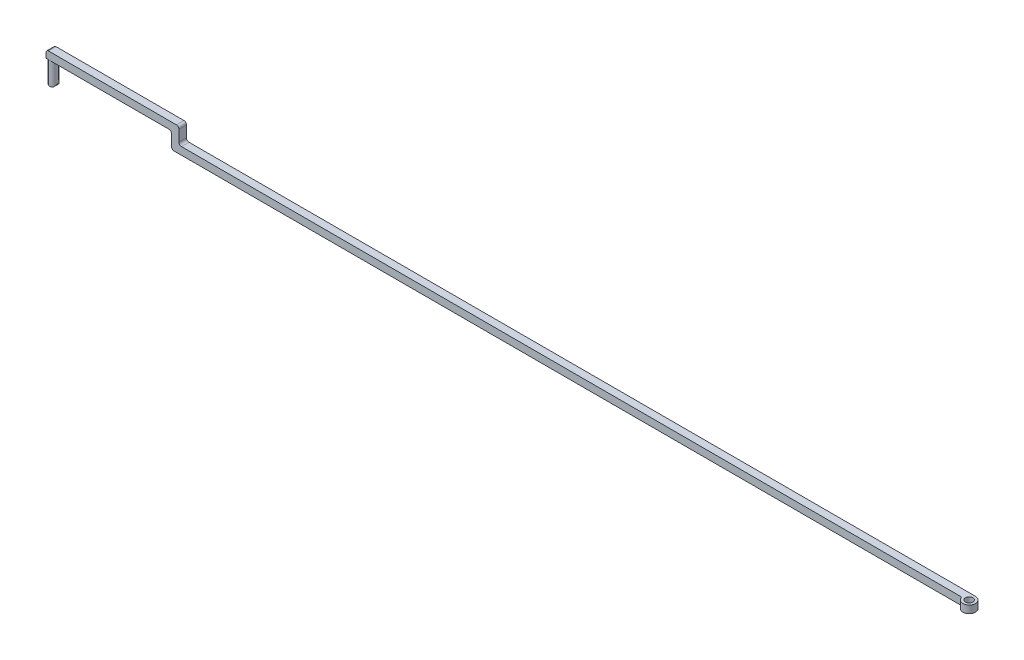
from build123d import *

# Parameters (mm, degrees)
SCHIZZO1_W                   = 185
SCHIZZO1_H                   = 6
ESTRUSIONE_ESTRUSIONE1_DEPTH = 1.5
SCHIZZO2_OUTSIDE_W           = 224.02
SCHIZZO2_OUTSIDE_H           = 45.02
TAGLIO_ESTRUSIONE1_DEPTH     = 1.5
SCHIZZO5_W                   = 2.294465176
SCHIZZO5_H                   = 1.827727815
SCHIZZO5_R                   = 0.75
TAGLIO_ESTRUSIONE3_DEPTH     = 4.5
SCHIZZO6_R                   = 1.25
ESTRUSIONE_ESTRUSIONE3_DEPTH = 1.5
SCHIZZO7_R                   = 0.75
TAGLIO_ESTRUSIONE4_DEPTH     = 1.5


with BuildPart() as part:
    # Schizzo1 → Estrusione-Estrusione1 (new body)
    with BuildSketch(Plane.XY):
        with Locations((-92.5, 3)):
            Rectangle(SCHIZZO1_W, SCHIZZO1_H)
    extrude(amount=ESTRUSIONE_ESTRUSIONE1_DEPTH)

    # Schizzo2 outside → Taglio-Estrusione1 (cut)
    with BuildSketch(Plane.XY.offset(1.5)):
        with Locations((-92.5, 3)):
            Rectangle(SCHIZZO2_OUTSIDE_W, SCHIZZO2_OUTSIDE_H)
        with BuildLine():
            Line((-184.5, 0), (-184, 0))
            ThreePointArc((-184, 0), (-183.646446609, 0.146446609), (-183.5, 0.5))
            Line((-183.5, 0.5), (-183.5, 4))
            ThreePointArc((-183.5, 4), (-183.353553391, 4.353553391), (-183, 4.5))
            Line((-183, 4.5), (-160.5, 4.5))
            ThreePointArc((-160.5, 4.5), (-160.146446609, 4.353553391), (-160, 4))
            Line((-160, 4), (-160, 1.75))
            ThreePointArc((-160, 1.75), (-159.853553391, 1.396446609), (-159.5, 1.25))
            Line((-159.5, 1.25), (0, 1.25))
            Line((0, 1.25), (0, 2.75))
            Line((0, 2.75), (-158, 2.75))
            ThreePointArc((-158, 2.75), (-158.353553391, 2.896446609), (-158.5, 3.25))
            Line((-158.5, 3.25), (-158.5, 5.5))
            ThreePointArc((-158.5, 5.5), (-158.646446609, 5.853553391), (-159, 6))
            Line((-159, 6), (-184.5, 6))
            ThreePointArc((-184.5, 6), (-184.853553391, 5.853553391), (-185, 5.5))
            Line((-185, 5.5), (-185, 0.5))
            ThreePointArc((-185, 0.5), (-184.853553391, 0.146446609), (-184.5, 0))
        make_face(mode=Mode.SUBTRACT)
    extrude(amount=-TAGLIO_ESTRUSIONE1_DEPTH, mode=Mode.SUBTRACT)

    # Schizzo5 → Taglio-Estrusione3 (cut)
    with BuildSketch(Plane.XZ):
        with Locations((-184.019602527, 0.694189627)):
            Rectangle(SCHIZZO5_W, SCHIZZO5_H)
        with Locations(Location((-184.25, 0.75, 0), (0, 0, 180))):
            Circle(SCHIZZO5_R, mode=Mode.SUBTRACT)
    extrude(amount=-TAGLIO_ESTRUSIONE3_DEPTH, mode=Mode.SUBTRACT)

    # Schizzo6 → Estrusione-Estrusione3 (add)
    with BuildSketch(Plane(origin=(0, 2.75, 0), x_dir=(1, 0, 0), z_dir=(0, 1, 0))):
        with Locations((-1.224744871, -1.25)):
            Circle(SCHIZZO6_R)
    extrude(amount=-ESTRUSIONE_ESTRUSIONE3_DEPTH)

    # Schizzo7 → Taglio-Estrusione4 (cut)
    with BuildSketch(Plane(origin=(0, 2.75, 0), x_dir=(1, 0, 0), z_dir=(0, 1, 0))):
        with Locations(Location((-1.224744871, -1.25, 0), (0, 0, 270))):
            Circle(SCHIZZO7_R)
        with BuildLine():
            Line((-1.224744871, 0), (-1.224744871, 0.534346319))
            Line((-1.224744871, 0.534346319), (0.72573961, 0.534346319))
            Line((0.72573961, 0.534346319), (0.72573961, -1.25))
            Line((0.72573961, -1.25), (0.025255129, -1.25))
            ThreePointArc((0.025255129, -1.25), (-0.340861395, -0.366116524), (-1.224744871, 0))
        make_face()
    extrude(amount=-TAGLIO_ESTRUSIONE4_DEPTH, mode=Mode.SUBTRACT)


solid = part.part
